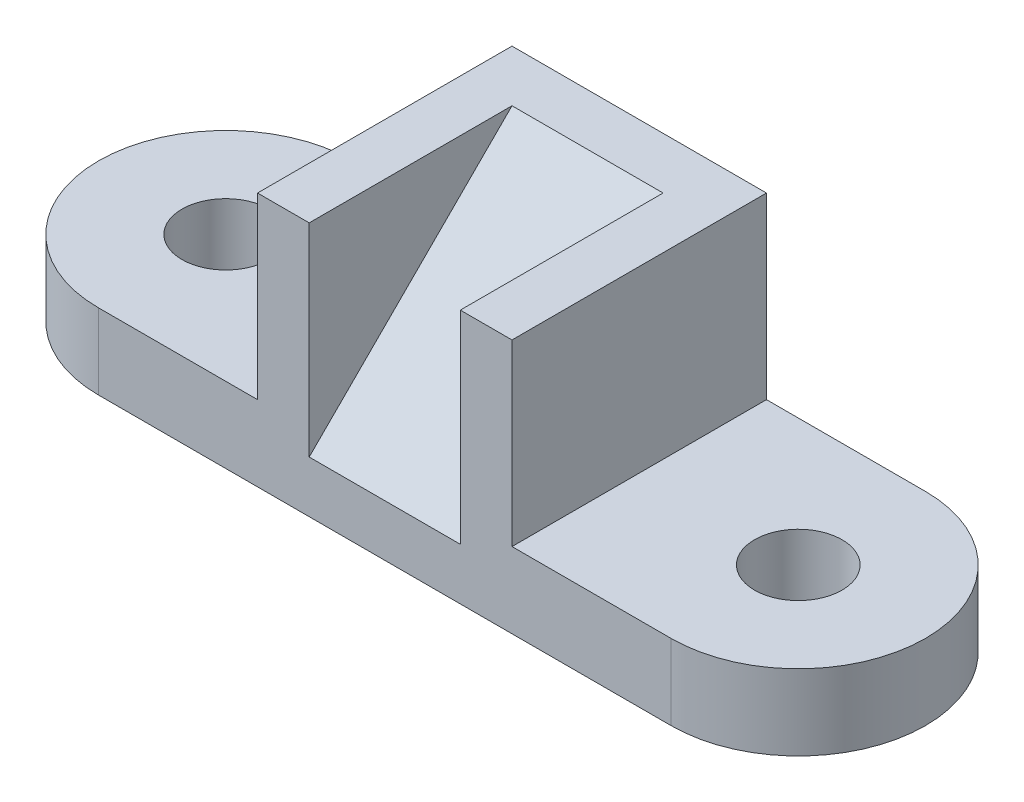
from build123d import *

# Parameters (mm, degrees)
SKETCH1_R           = 11
BOSS_EXTRUDE1_DEPTH = 19
SKETCH2_W           = 64
SKETCH2_H           = 64
BOSS_EXTRUDE2_DEPTH = 45
CUT_EXTRUDE2_START  = -13
CUT_EXTRUDE2_DEPTH  = 38


with BuildPart() as part:
    # Sketch1 → Boss-Extrude1 (new body)
    with BuildSketch(Plane(origin=(0, 0, 0), x_dir=(1, 0, 0), z_dir=(0, 1, 0))):
        with BuildLine():
            Line((-72, 32), (72, 32))
            ThreePointArc((72, 32), (104, 0), (72, -32))
            Line((72, -32), (-72, -32))
            ThreePointArc((-72, -32), (-104, 0), (-72, 32))
        make_face()
        with Locations(Location((-72, 0, 0), (0, 0, 270))):
            Circle(SKETCH1_R, mode=Mode.SUBTRACT)
        with Locations(Location((72, 0, 0), (0, 0, 270))):
            Circle(SKETCH1_R, mode=Mode.SUBTRACT)
    extrude(amount=BOSS_EXTRUDE1_DEPTH)

    # Sketch2 → Boss-Extrude2 (add)
    with BuildSketch(Plane(origin=(0, 19, 0), x_dir=(1, 0, 0), z_dir=(0, 1, 0))):
        Rectangle(SKETCH2_W, SKETCH2_H)
    extrude(amount=BOSS_EXTRUDE2_DEPTH)

    # Sketch4 → Cut-Extrude2 (cut)
    with BuildSketch(Plane.ZY.offset(32).offset(CUT_EXTRUDE2_START)):
        Polygon((32, 64), (-19, 64), (32, 13), align=None)
    extrude(amount=-CUT_EXTRUDE2_DEPTH, mode=Mode.SUBTRACT)


solid = part.part
